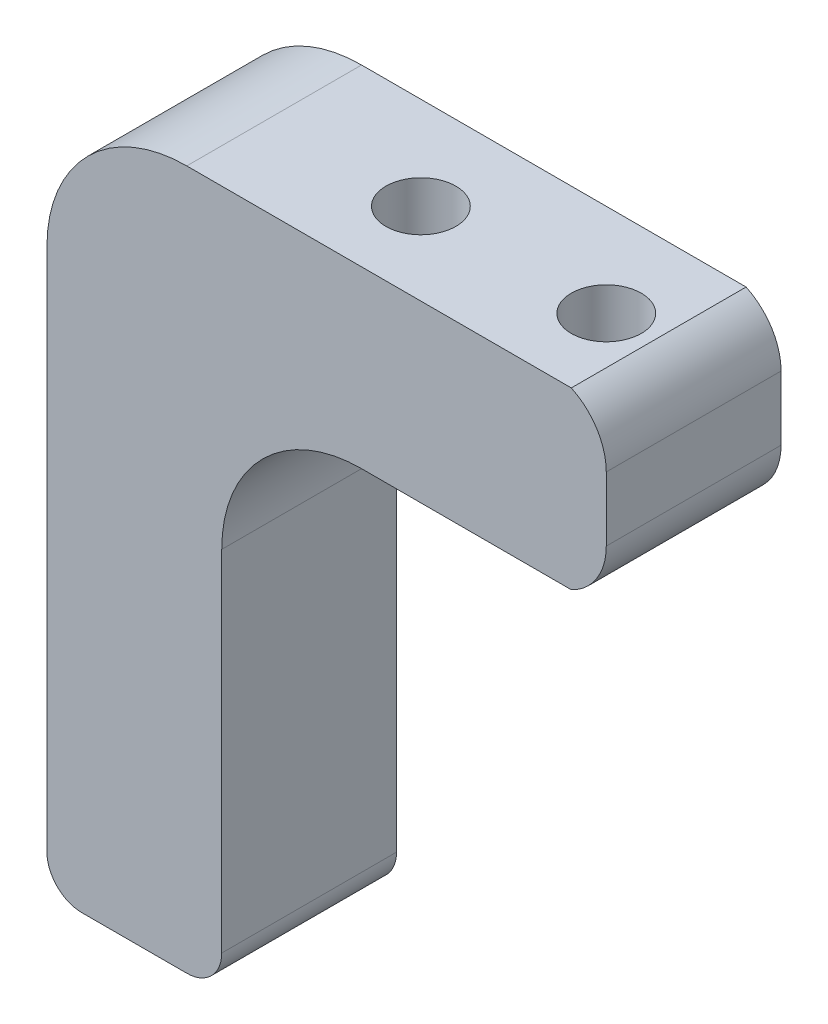
from build123d import *

# Parameters (mm, degrees)
SALIENTE_EXTRUIR1_DEPTH = 10
CROQUIS2_R              = 2
CORTAR_EXTRUIR2_DEPTH   = 30
CORTAR_EXTRUIR3_START   = -10
CORTAR_EXTRUIR3_DEPTH   = 10


with BuildPart() as part:
    # Croquis1 → Saliente-Extruir1 (new body)
    with BuildSketch(Plane.XY):
        with BuildLine():
            Line((2, 0), (8, 0))
            ThreePointArc((8, 0), (9.414213562, 0.585786438), (10, 2))
            Line((10, 2), (10, 22))
            ThreePointArc((10, 22), (12.343145751, 27.656854249), (18, 30))
            Line((18, 30), (36, 30))
            ThreePointArc((36, 30), (38.828427125, 31.171572875), (40, 34))
            Line((40, 34), (40, 36))
            ThreePointArc((40, 36), (38.828427125, 38.828427125), (36, 40))
            Line((36, 40), (8, 40))
            ThreePointArc((8, 40), (2.343145751, 37.656854249), (0, 32))
            Line((0, 32), (0, 2))
            ThreePointArc((0, 2), (0.585786438, 0.585786438), (2, 0))
        make_face()
    extrude(amount=SALIENTE_EXTRUIR1_DEPTH)

    # Croquis2 → Cortar-Extruir2 (cut)
    with BuildSketch(Plane(origin=(0, 40, 0), x_dir=(1, 0, 0), z_dir=(0, 1, 0))):
        with Locations(Location((16.696699141, -5.303300859, 0), (0, 0, 180))):
            Circle(CROQUIS2_R)
        with Locations(Location((27.303300859, -5.303300859, 0), (0, 0, 180))):
            Circle(CROQUIS2_R)
    extrude(amount=-CORTAR_EXTRUIR2_DEPTH, mode=Mode.SUBTRACT)

    # Croquis3 → Cortar-Extruir3 (cut)
    with BuildSketch(Plane.XY.offset(10).offset(CORTAR_EXTRUIR3_START)):
        with BuildLine():
            Line((32, 36.83772234), (32, 33.16227766))
            ThreePointArc((32, 33.16227766), (31.458039892, 31.291448967), (30, 30))
            Line((30, 30), (36, 30))
            ThreePointArc((36, 30), (38.828427125, 31.171572875), (40, 34))
            Line((40, 34), (40, 36))
            ThreePointArc((40, 36), (38.828427125, 38.828427125), (36, 40))
            Line((36, 40), (30, 40))
            ThreePointArc((30, 40), (31.458039892, 38.708551033), (32, 36.83772234))
        make_face()
    extrude(amount=CORTAR_EXTRUIR3_DEPTH, mode=Mode.SUBTRACT)


solid = part.part
